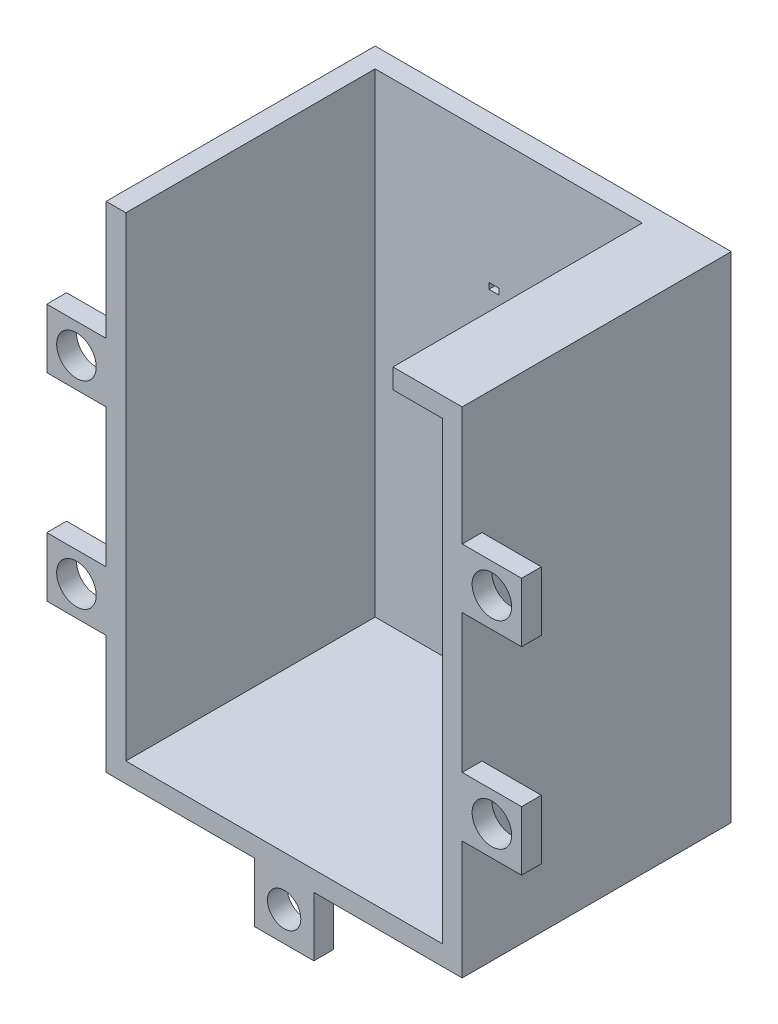
from build123d import *

# Parameters (mm, degrees)
SKETCH1_W           = 36
SKETCH1_H           = 50
BOSS_EXTRUDE1_DEPTH = 27.2
CUT_EXTRUDE1_REACH  = 69.349
SKETCH2_R           = 3
SKETCH8_W           = 32
SKETCH8_H           = 46
CUT_EXTRUDE2_DEPTH  = 25.2
SKETCH12_W          = 1
SKETCH12_H          = 0.6
SKETCH12_W_2        = 0.8
SKETCH12_H_2        = 1.2
CUT_EXTRUDE3_DEPTH  = 25.2
SKETCH14_W          = 32
SKETCH14_H          = 25.2
CUT_EXTRUDE4_DEPTH  = 25.2
SKETCH16_W          = 5
SKETCH16_H          = 25.2
BOSS_EXTRUDE2_DEPTH = 2
SKETCH17_W          = 6
SKETCH17_H          = 6
BOSS_EXTRUDE3_DEPTH = 2
SKETCH18_R          = 2
CUT_EXTRUDE5_DEPTH  = 2
SKETCH20_W          = 6
SKETCH20_H          = 6
BOSS_EXTRUDE4_DEPTH = 2
SKETCH21_R          = 1.684389361
CUT_EXTRUDE6_DEPTH  = 2


with BuildPart() as part:
    # Sketch1 → Boss-Extrude1 (new body)
    with BuildSketch(Plane.XY):
        with Locations((18, 25)):
            Rectangle(SKETCH1_W, SKETCH1_H)
    extrude(amount=-BOSS_EXTRUDE1_DEPTH)

    # Sketch2 → Cut-Extrude1 (cut, up to next)
    with BuildSketch(Plane.XY, mode=Mode.PRIVATE) as cut_extrude1_sk1:
        with Locations((18, 33)):
            Circle(SKETCH2_R)
    cut_extrude1_tool1 = extrude(cut_extrude1_sk1.sketch, amount=-CUT_EXTRUDE1_REACH, mode=Mode.PRIVATE) & part.part
    add(cut_extrude1_tool1.solids().sort_by_distance((18, 33, 0))[0], mode=Mode.SUBTRACT)

    # Sketch8 → Cut-Extrude2 (cut)
    with BuildSketch(Plane.XY):
        with Locations((18, 25)):
            Rectangle(SKETCH8_W, SKETCH8_H)
    extrude(amount=-CUT_EXTRUDE2_DEPTH, mode=Mode.SUBTRACT)

    # Sketch12 → Cut-Extrude3 (cut)
    with BuildSketch(Plane(origin=(0, 0, -27.2), x_dir=(-1, 0, 0), z_dir=(0, 0, -1))):
        with Locations((-14, 13.25)):
            Rectangle(SKETCH12_W, SKETCH12_H)
        with Locations((-18, 13.25)):
            Rectangle(SKETCH12_W, SKETCH12_H)
        with Locations((-22, 13.25)):
            Rectangle(SKETCH12_W, SKETCH12_H)
        with Locations((-13, 23.35)):
            Rectangle(SKETCH12_W_2, SKETCH12_H_2)
        with Locations((-23, 23.35)):
            Rectangle(SKETCH12_W_2, SKETCH12_H_2)
    extrude(amount=-CUT_EXTRUDE3_DEPTH, mode=Mode.SUBTRACT)

    # Sketch14 → Cut-Extrude4 (cut)
    with BuildSketch(Plane.XZ):
        with Locations((18, -12.6)):
            Rectangle(SKETCH14_W, SKETCH14_H)
    extrude(amount=-CUT_EXTRUDE4_DEPTH, mode=Mode.SUBTRACT)

    # Sketch16 → Boss-Extrude2 (add)
    with BuildSketch(Plane(origin=(0, 0, 0), x_dir=(-1, 0, 0), z_dir=(0, -1, 0))):
        with Locations((-31.5, 12.6)):
            Rectangle(SKETCH16_W, SKETCH16_H)
    extrude(amount=-BOSS_EXTRUDE2_DEPTH)

    # Sketch20 → Boss-Extrude4 (add)
    with BuildSketch(Plane.XY):
        with Locations((18, 53)):
            Rectangle(SKETCH20_W, SKETCH20_H)
    extrude(amount=-BOSS_EXTRUDE4_DEPTH)

    # Sketch21 → Cut-Extrude6 (cut)
    with BuildSketch(Plane.XY):
        with Locations((18, 53)):
            Circle(SKETCH21_R)
    extrude(amount=-CUT_EXTRUDE6_DEPTH, mode=Mode.SUBTRACT)


with BuildPart() as body_2:
    # Sketch17 → Boss-Extrude3 (new body)
    with BuildSketch(Plane.XY):
        with Locations((39, 35)):
            Rectangle(SKETCH17_W, SKETCH17_H)
    extrude(amount=-BOSS_EXTRUDE3_DEPTH)

    # Sketch18 → Cut-Extrude5 (cut)
    with BuildSketch(Plane.XY):
        with Locations((39, 35)):
            Circle(SKETCH18_R)
    extrude(amount=-CUT_EXTRUDE5_DEPTH, mode=Mode.SUBTRACT)


with BuildPart() as body_3:
    # Mirror1: mirrored copy
    add(body_2.part.mirror(Plane(origin=(0, 25, 0), x_dir=(0, 0, 1), z_dir=(0, -1, 0))))


with BuildPart() as body_4:
    # Mirror2: mirrored copy
    add(body_2.part.mirror(Plane.ZY.offset(-18)))


with BuildPart() as body_5:
    # Mirror2 2: mirrored copy
    add(body_3.part.mirror(Plane.ZY.offset(-18)))


with BuildPart() as part_1:
    add(part.part)

    # Combine1: union body 3, body 2, body 4, body 5
    add(body_3.part)
    add(body_2.part)
    add(body_4.part)
    add(body_5.part)


with BuildPart() as body_2_2:
    # Mirror6: mirrored copy
    add(part_1.part.mirror(Plane(origin=(0, 0, 0), x_dir=(0, 0, 1), z_dir=(0, -1, 0))))


solid = body_2_2.part
